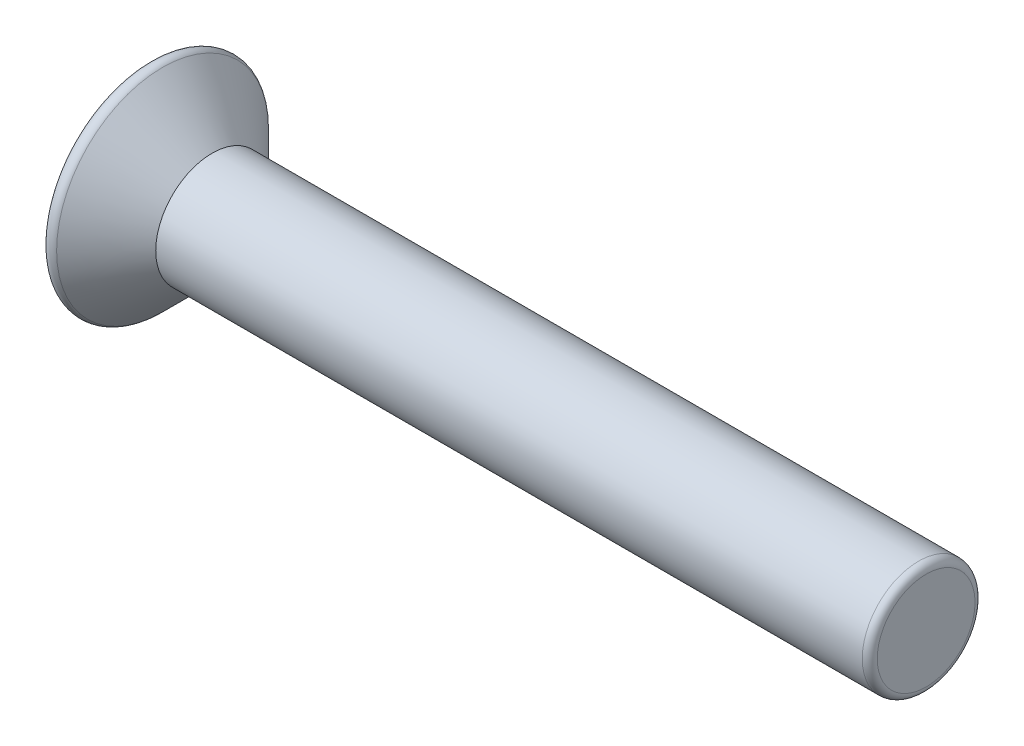
from build123d import *

# Parameters (mm, degrees)
ENL_V_MAT_EXTRU_1_DEPTH = 0.1
CONG_1_R                = 0.2


with BuildPart() as part:
    # Esquisse1 → Révolution1 (revolve)
    with BuildSketch(Plane.XY, mode=Mode.PRIVATE) as r_volution1_sk:
        Polygon((0, 0), (0, 3.16), (1.66, 1.5), (20.66, 1.5), (20.66, 0), align=None)
    revolve(r_volution1_sk.sketch.rotate(Axis((-5.768945874, 0, 0), (1, 0, 0)), 90), axis=Axis((-5.768945874, 0, 0), (1, 0, 0)))

    # Esquisse2 → Enlèv. mat.-Extru.1 (cut)
    with BuildSketch(Plane.ZY):
        Polygon((0, -1.1), (0.952627944, -0.55), (0.952627944, 0.55), (0, 1.1), (-0.952627944, 0.55), (-0.952627944, -0.55), align=None)
    extrude(amount=-ENL_V_MAT_EXTRU_1_DEPTH, mode=Mode.SUBTRACT)

    # Congé1
    cong_1_edges = [part.edges().sort_by_distance(p)[0] for p in [
        (20.66, 0, -1.5),
        (0, 0, -3.16),
    ]]
    fillet(cong_1_edges, radius=CONG_1_R)


solid = part.part
